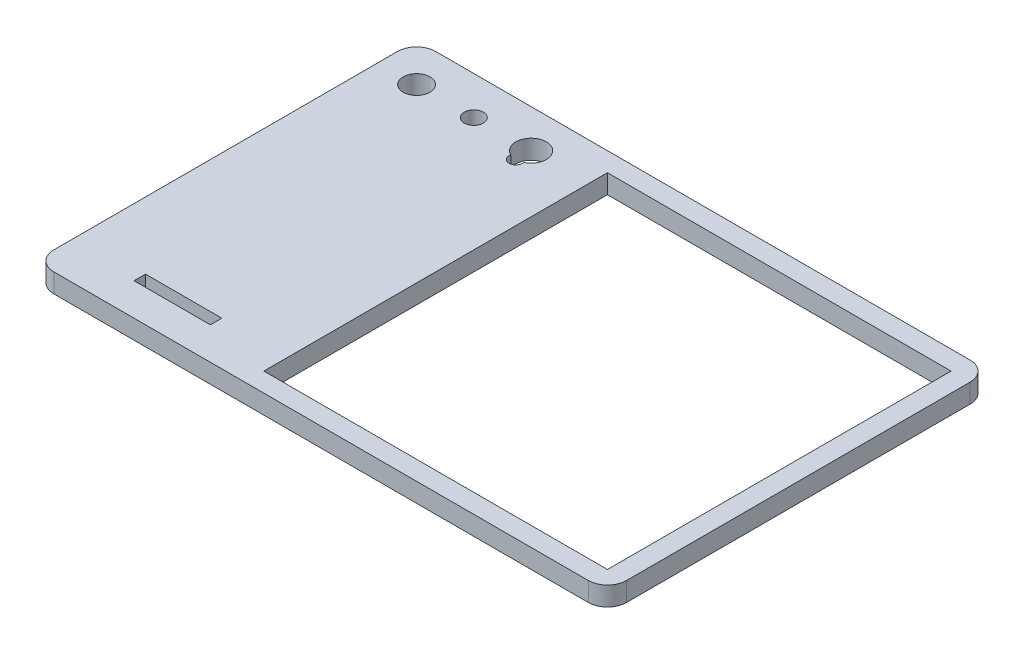
from build123d import *

# Parameters (mm, degrees)
SKETCH1_W           = 150
SKETCH1_H           = 100
SKETCH1_W_2         = 90
SKETCH1_H_2         = 90
BOSS_EXTRUDE1_DEPTH = 5
FILLET1_R           = 5
SKETCH2_R           = 3.5
SKETCH2_R_2         = 2.5
SKETCH2_R_3         = 1.75
SKETCH2_R_4         = 4
SKETCH2_W           = 20
SKETCH2_H           = 3
CUT_EXTRUDE3_DEPTH  = 5


with BuildPart() as part:
    # Sketch1 → Boss-Extrude1 (new body)
    with BuildSketch(Plane(origin=(0, 0, 0), x_dir=(1, 0, 0), z_dir=(0, 1, 0))):
        Rectangle(SKETCH1_W, SKETCH1_H)
        with Locations((25, 0)):
            Rectangle(SKETCH1_W_2, SKETCH1_H_2, mode=Mode.SUBTRACT)
    extrude(amount=BOSS_EXTRUDE1_DEPTH)

    # Fillet1
    fillet1_edges = [part.edges().sort_by_distance(p)[0] for p in [
        (75, 2.5, 50),
        (-75, 2.5, 50),
        (-75, 2.5, -50),
        (75, 2.5, -50),
    ]]
    fillet(fillet1_edges, radius=FILLET1_R)

    # Sketch2 → Cut-Extrude3 (cut)
    with BuildSketch(Plane(origin=(0, 5, 0), x_dir=(1, 0, 0), z_dir=(0, 1, 0))):
        with Locations(Location((-65, 40, 0), (0, 0, 270))):
            Circle(SKETCH2_R)
        with Locations(Location((-50, 40, 0), (0, 0, 270))):
            Circle(SKETCH2_R_2)
        with Locations((-35, 36)):
            Circle(SKETCH2_R_3)
        with Locations((-35, 40)):
            Circle(SKETCH2_R_4)
        with Locations((-47.5, -40)):
            Rectangle(SKETCH2_W, SKETCH2_H)
    extrude(amount=-CUT_EXTRUDE3_DEPTH, mode=Mode.SUBTRACT)


solid = part.part
